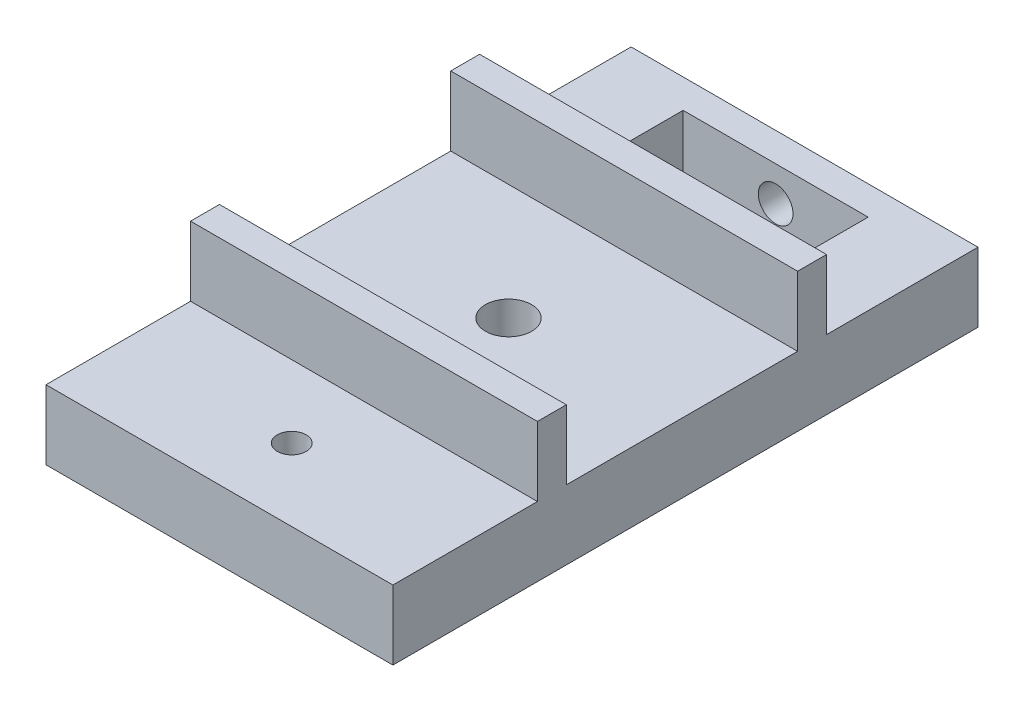
from build123d import *

# Parameters (mm, degrees)
SKETCH1_W           = 30
SKETCH1_H           = 38.1
SKETCH1_W_2         = 16
SKETCH1_H_2         = 10.6
BOSS_EXTRUDE1_DEPTH = 6
SKETCH1_3_W         = 30
SKETCH1_3_H         = 2.5
BOSS_EXTRUDE2_DEPTH = 12
SKETCH3_R           = 1.5
CUT_EXTRUDE2_DEPTH  = 15
SKETCH2_R           = 2
CUT_EXTRUDE1_DEPTH  = 38.976966704
SKETCH5_W           = 30
SKETCH5_H           = 12.5
SKETCH5_R           = 1.25
BOSS_EXTRUDE3_DEPTH = 6


with BuildPart() as part:
    # Sketch1 → Boss-Extrude1 (new body)
    with BuildSketch(Plane(origin=(0, 0, 0), x_dir=(1, 0, 0), z_dir=(0, 1, 0))):
        with Locations((-15, -3.45)):
            Rectangle(SKETCH1_W, SKETCH1_H)
        with Locations((-15, 7.8)):
            Rectangle(SKETCH1_W_2, SKETCH1_H_2, mode=Mode.SUBTRACT)
    extrude(amount=BOSS_EXTRUDE1_DEPTH)

    # Sketch1<3> → Boss-Extrude2 (add)
    with BuildSketch(Plane(origin=(0, 0, 0), x_dir=(1, 0, 0), z_dir=(0, 1, 0))):
        with Locations((-15, -21.25)):
            Rectangle(SKETCH1_3_W, SKETCH1_3_H)
        with Locations((-15, 1.25)):
            Rectangle(SKETCH1_3_W, SKETCH1_3_H)
    extrude(amount=BOSS_EXTRUDE2_DEPTH)

    # Sketch3 → Cut-Extrude2 (cut)
    with BuildSketch(Plane(origin=(0, 0, -15.6), x_dir=(-1, 0, 0), z_dir=(0, 0, -1))):
        with Locations((15, 3)):
            Circle(SKETCH3_R)
    extrude(amount=-CUT_EXTRUDE2_DEPTH, mode=Mode.SUBTRACT)

    # Sketch2 → Cut-Extrude1 (cut, through all)
    with BuildSketch(Plane(origin=(0, 6, 0), x_dir=(1, 0, 0), z_dir=(0, 1, 0))):
        with Locations((-15, -10)):
            Circle(SKETCH2_R)
    extrude(amount=-CUT_EXTRUDE1_DEPTH, mode=Mode.SUBTRACT)

    # Sketch5 → Boss-Extrude3 (add)
    with BuildSketch(Plane.XZ):
        with Locations((-15, 28.75)):
            Rectangle(SKETCH5_W, SKETCH5_H)
        with Locations((-15, 28.75)):
            Circle(SKETCH5_R, mode=Mode.SUBTRACT)
    extrude(amount=-BOSS_EXTRUDE3_DEPTH)


solid = part.part
